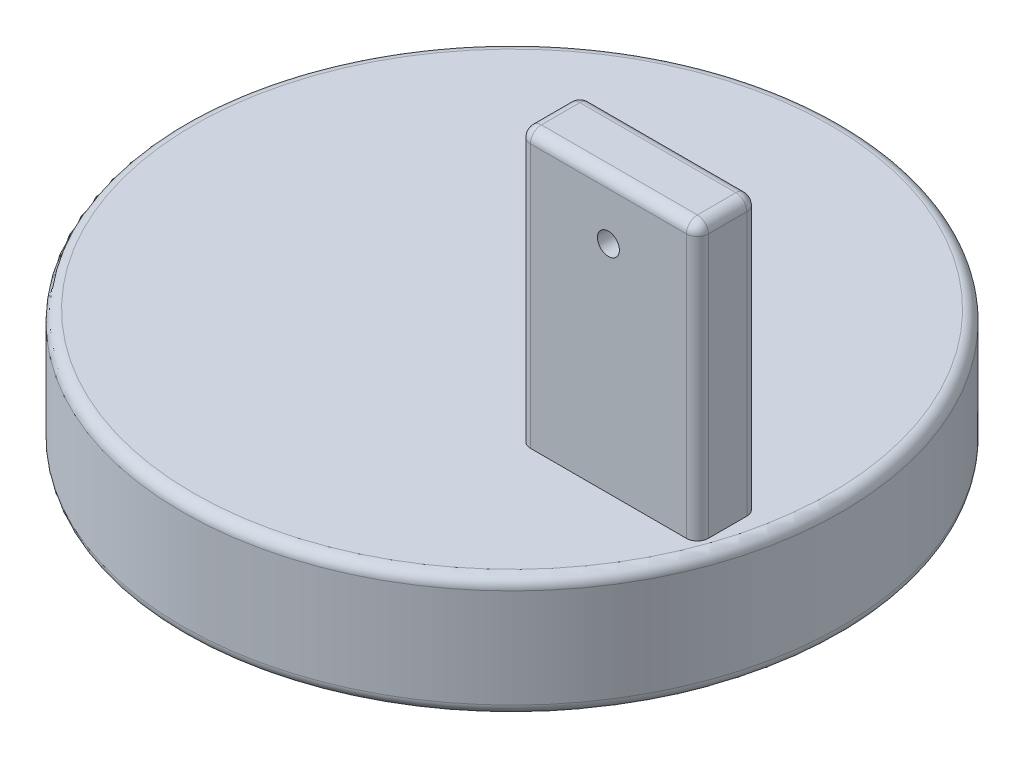
from build123d import *

# Parameters (mm, degrees)
SKETCH_2_R          = 30
EXTRUDE_1_DEPTH     = 11
SKETCH_3_W          = 16.2
SKETCH_3_H          = 25
SKETCH_3_R          = 1
EXTRUDE_2_DEPTH     = 5.5
FILLET_1_R          = 1
SKETCH_4_R          = 1.3
CUT_EXTRUDE_1_DEPTH = 5


with BuildPart() as part:
    # 草图2 → 凸台-拉伸1 (new body)
    with BuildSketch(Plane(origin=(0, 0, 0), x_dir=(1, 0, 0), z_dir=(0, 1, 0))):
        with Locations(Location((0, 0, 0), (0, 0, 270))):
            Circle(SKETCH_2_R)
    extrude(amount=EXTRUDE_1_DEPTH)

    # 草图3 → 凸台-拉伸2 (add)
    with BuildSketch(Plane.XY.offset(4.63)):
        with Locations((18.9, 23.5)):
            Rectangle(SKETCH_3_W, SKETCH_3_H)
        with Locations((18.9, 30.67)):
            Circle(SKETCH_3_R, mode=Mode.SUBTRACT)
    extrude(amount=EXTRUDE_2_DEPTH)

    # 圆角1
    fillet_1_edges = [part.edges().sort_by_distance(p)[0] for p in [
        (27, 36, 7.38),
        (10.8, 23.5, 4.63),
        (10.8, 36, 7.38),
        (0, 0, -30),
        (0, 11, -30),
        (27, 23.5, 10.13),
        (18.9, 36, 10.13),
        (10.8, 23.5, 10.13),
        (27, 23.5, 4.63),
        (18.9, 36, 4.63),
    ]]
    fillet(fillet_1_edges, radius=FILLET_1_R)

    # 草图4 → 切除-拉伸1 (cut)
    with BuildSketch(Plane(origin=(0, 0, 0), x_dir=(-1, 0, 0), z_dir=(0, -1, 0))):
        with Locations(Location((0, -13, 0), (0, 0, 90))):
            Circle(SKETCH_4_R)
        with Locations(Location((-13, 0, 0), (0, 0, 90))):
            Circle(SKETCH_4_R)
        with Locations(Location((0, 13, 0), (0, 0, 90))):
            Circle(SKETCH_4_R)
        with Locations(Location((13, 0, 0), (0, 0, 90))):
            Circle(SKETCH_4_R)
    extrude(amount=-CUT_EXTRUDE_1_DEPTH, mode=Mode.SUBTRACT)


solid = part.part
